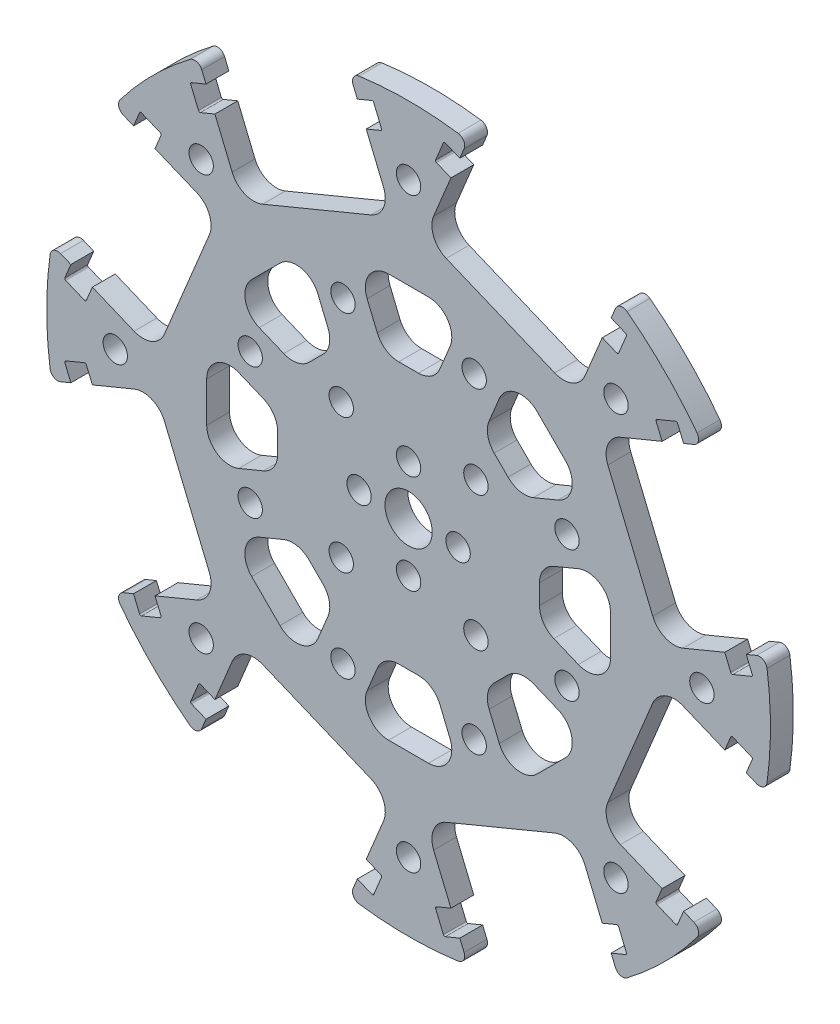
from build123d import *

# Parameters (mm, degrees)
SKETCH_1_R                       = 47.5
EXTRUDE_1_DEPTH                  = 3
CUT_EXTRUDE_1_DEPTH              = 68.242099908
CUT_EXTRUDE_2_DEPTH              = 68.242099908
CUT_EXTRUDE_2_DEPTH_BACK         = 68.242099908
SKETCH_3_R                       = 3.1
SKETCH_3_R_2                     = 1.6
SKETCH_4_R                       = 1.6
CUT_EXTRUDE_3_DEPTH              = 68.242099908
CUT_EXTRUDE_4_DEPTH              = 68.242099908
FILLET_1_R                       = 1
FILLET_2_R                       = 0.2
FILLET_3_R                       = 3.05
FILLET_4_R                       = 3.05
PATTERN_CIRCULAR_1_COUNT         = 8
FILLET_1_OF_PATTERN_CIRCULAR_1_R = 1
FILLET_2_OF_PATTERN_CIRCULAR_1_R = 0.2
FILLET_3_OF_PATTERN_CIRCULAR_1_R = 3.05
FILLET_4_OF_PATTERN_CIRCULAR_1_R = 3.05


with BuildPart() as part:
    # ｽｹｯﾁ1 → ﾎﾞｽ - 押し出し1 (new body)
    with BuildSketch(Plane.XY):
        Circle(SKETCH_1_R)
    extrude(amount=EXTRUDE_1_DEPTH)

    # ｽｹｯﾁ2 → ｶｯﾄ - 押し出し1 (cut, through all)
    with BuildSketch(Plane.XY.offset(3)):
        Polygon((6.724591419, 44.32570355), (10.159175225, 52.617522355), (30.022585174, 44.389828559), (26.588001368, 36.098009755), (28.666730316, 35.236972032), (27.499545848, 32.419139458), (25.420816899, 33.28017718), (21.986233094, 24.988358376), (2.122823145, 33.216052172), (5.55740695, 41.507870976), (3.478678002, 42.368908699), (4.645862471, 45.186741273), align=None)
    cut_extrude_1 = extrude(amount=-CUT_EXTRUDE_1_DEPTH, mode=Mode.SUBTRACT)

    # ｽｹｯﾁ3 → ｶｯﾄ - 押し出し2 (cut, two sides: drawn at the far end of the back side and taken through both)
    with BuildSketch(Plane.XY.offset(3).offset(-CUT_EXTRUDE_2_DEPTH_BACK)):
        Circle(SKETCH_3_R)
        with Locations((0, 6.5)):
            Circle(SKETCH_3_R_2)
        with Locations((6.5, 0)):
            Circle(SKETCH_3_R_2)
        with Locations((0, -6.5)):
            Circle(SKETCH_3_R_2)
        with Locations((-6.5, 0)):
            Circle(SKETCH_3_R_2)
        with Locations((8.838834765, 8.838834765)):
            Circle(SKETCH_3_R_2)
        with Locations((8.838834765, -8.838834765)):
            Circle(SKETCH_3_R_2)
        with Locations((-8.838834765, -8.838834765)):
            Circle(SKETCH_3_R_2)
        with Locations((-8.838834765, 8.838834765)):
            Circle(SKETCH_3_R_2)
    extrude(amount=CUT_EXTRUDE_2_DEPTH + CUT_EXTRUDE_2_DEPTH_BACK, mode=Mode.SUBTRACT)

    # ｽｹｯﾁ4 → ｶｯﾄ - 押し出し3 (cut, through all)
    with BuildSketch(Plane.XY.offset(3)):
        with Locations((27.223611076, 27.223611076)):
            Circle(SKETCH_4_R)
        with Locations((8.610377228, 20.787289482)):
            Circle(SKETCH_4_R)
    cut_extrude_3 = extrude(amount=-CUT_EXTRUDE_3_DEPTH, mode=Mode.SUBTRACT)

    # ｽｹｯﾁ5 → ｶｯﾄ - 押し出し4 (cut, symmetric)
    with BuildSketch(Plane.XY.offset(3)):
        Polygon((3.328075632, 17.180626082), (7.188286702, 26.5), (-7.188286702, 26.5), (-3.328075632, 17.180626082), align=None)
    cut_extrude_4 = extrude(amount=CUT_EXTRUDE_4_DEPTH, both=True, mode=Mode.SUBTRACT)

    # ﾌｨﾚｯﾄ1
    fillet_1_edges = [part.edges().sort_by_distance(p)[0] for p in [
        (27.637535262, 38.631808716, 1.5),
        (7.774125313, 46.859502511, 1.5),
    ]]
    fillet(fillet_1_edges, radius=FILLET_1_R)

    # ﾌｨﾚｯﾄ2
    fillet_2_edges = [part.edges().sort_by_distance(p)[0] for p in [
        (28.666730316, 35.236972032, 1.5),
        (27.499545848, 32.419139458, 1.5),
        (4.645862471, 45.186741273, 1.5),
        (3.478678002, 42.368908699, 1.5),
    ]]
    fillet(fillet_2_edges, radius=FILLET_2_R)

    # ﾌｨﾚｯﾄ3
    fillet_3_edges = [part.edges().sort_by_distance(p)[0] for p in [
        (21.986233094, 24.988358376, 1.5),
        (2.122823145, 33.216052172, 1.5),
    ]]
    fillet(fillet_3_edges, radius=FILLET_3_R)

    # ﾌｨﾚｯﾄ4
    fillet_4_edges = [part.edges().sort_by_distance(p)[0] for p in [
        (7.188286702, 26.5, 1.5),
        (-7.188286702, 26.5, 1.5),
        (3.328075632, 17.180626082, 1.5),
        (-3.328075632, 17.180626082, 1.5),
    ]]
    fillet(fillet_4_edges, radius=FILLET_4_R)

    # 円形ﾊﾟﾀｰﾝ1: ｶｯﾄ - 押し出し1, ｶｯﾄ - 押し出し3, ｶｯﾄ - 押し出し4 ×8 about axis
    pattern_circular_1_axis = Axis((0, 0, 0), (0, 0, 1))
    add([cut_extrude_1.rotate(pattern_circular_1_axis, i * 360 / PATTERN_CIRCULAR_1_COUNT) for i in range(1, PATTERN_CIRCULAR_1_COUNT)], mode=Mode.SUBTRACT)
    add([cut_extrude_3.rotate(pattern_circular_1_axis, i * 360 / PATTERN_CIRCULAR_1_COUNT) for i in range(1, PATTERN_CIRCULAR_1_COUNT)], mode=Mode.SUBTRACT)
    add([cut_extrude_4.rotate(pattern_circular_1_axis, i * 360 / PATTERN_CIRCULAR_1_COUNT) for i in range(1, PATTERN_CIRCULAR_1_COUNT)], mode=Mode.SUBTRACT)

    # ﾌｨﾚｯﾄ1 of 円形ﾊﾟﾀｰﾝ1
    fillet_1_of_pattern_circular_1_edges = [part.edges().sort_by_distance(p)[0] for p in [
        (-7.774125313, 46.859502511, 1.5),
        (-27.637535262, 38.631808716, 1.5),
        (-38.631808716, 27.637535262, 1.5),
        (-46.859502511, 7.774125313, 1.5),
        (-46.859502511, -7.774125313, 1.5),
        (-38.631808716, -27.637535262, 1.5),
        (-27.637535262, -38.631808716, 1.5),
        (-7.774125313, -46.859502511, 1.5),
        (7.774125313, -46.859502511, 1.5),
        (27.637535262, -38.631808716, 1.5),
        (38.631808716, -27.637535262, 1.5),
        (46.859502511, -7.774125313, 1.5),
        (46.859502511, 7.774125313, 1.5),
        (38.631808716, 27.637535262, 1.5),
    ]]
    fillet(fillet_1_of_pattern_circular_1_edges, radius=FILLET_1_OF_PATTERN_CIRCULAR_1_R)

    # ﾌｨﾚｯﾄ2 of 円形ﾊﾟﾀｰﾝ1
    fillet_2_of_pattern_circular_1_edges = [part.edges().sort_by_distance(p)[0] for p in [
        (-4.645862471, 45.186741273, 1.5),
        (-3.478678002, 42.368908699, 1.5),
        (-28.666730316, 35.236972032, 1.5),
        (-27.499545848, 32.419139458, 1.5),
        (-35.236972032, 28.666730316, 1.5),
        (-32.419139458, 27.499545848, 1.5),
        (-45.186741273, 4.645862471, 1.5),
        (-42.368908699, 3.478678002, 1.5),
        (-45.186741273, -4.645862471, 1.5),
        (-42.368908699, -3.478678002, 1.5),
        (-35.236972032, -28.666730316, 1.5),
        (-32.419139458, -27.499545848, 1.5),
        (-28.666730316, -35.236972032, 1.5),
        (-27.499545848, -32.419139458, 1.5),
        (-4.645862471, -45.186741273, 1.5),
        (-3.478678002, -42.368908699, 1.5),
        (4.645862471, -45.186741273, 1.5),
        (3.478678002, -42.368908699, 1.5),
        (28.666730316, -35.236972032, 1.5),
        (27.499545848, -32.419139458, 1.5),
        (35.236972032, -28.666730316, 1.5),
        (32.419139458, -27.499545848, 1.5),
        (45.186741273, -4.645862471, 1.5),
        (42.368908699, -3.478678002, 1.5),
        (45.186741273, 4.645862471, 1.5),
        (42.368908699, 3.478678002, 1.5),
        (35.236972032, 28.666730316, 1.5),
        (32.419139458, 27.499545848, 1.5),
    ]]
    fillet(fillet_2_of_pattern_circular_1_edges, radius=FILLET_2_OF_PATTERN_CIRCULAR_1_R)

    # ﾌｨﾚｯﾄ3 of 円形ﾊﾟﾀｰﾝ1
    fillet_3_of_pattern_circular_1_edges = [part.edges().sort_by_distance(p)[0] for p in [
        (-2.122823145, 33.216052172, 1.5),
        (-21.986233094, 24.988358376, 1.5),
        (-24.988358376, 21.986233094, 1.5),
        (-33.216052172, 2.122823145, 1.5),
        (-33.216052172, -2.122823145, 1.5),
        (-24.988358376, -21.986233094, 1.5),
        (-21.986233094, -24.988358376, 1.5),
        (-2.122823145, -33.216052172, 1.5),
        (2.122823145, -33.216052172, 1.5),
        (21.986233094, -24.988358376, 1.5),
        (24.988358376, -21.986233094, 1.5),
        (33.216052172, -2.122823145, 1.5),
        (33.216052172, 2.122823145, 1.5),
        (24.988358376, 21.986233094, 1.5),
    ]]
    fillet(fillet_3_of_pattern_circular_1_edges, radius=FILLET_3_OF_PATTERN_CIRCULAR_1_R)

    # ﾌｨﾚｯﾄ4 of 円形ﾊﾟﾀｰﾝ1
    fillet_4_of_pattern_circular_1_edges = [part.edges().sort_by_distance(p)[0] for p in [
        (-13.655443429, 23.821215973, 1.5),
        (-23.821215973, 13.655443429, 1.5),
        (-9.79523236, 14.501842056, 1.5),
        (-14.501842056, 9.79523236, 1.5),
        (-26.5, 7.188286702, 1.5),
        (-26.5, -7.188286702, 1.5),
        (-17.180626082, 3.328075632, 1.5),
        (-17.180626082, -3.328075632, 1.5),
        (-23.821215973, -13.655443429, 1.5),
        (-13.655443429, -23.821215973, 1.5),
        (-14.501842056, -9.79523236, 1.5),
        (-9.79523236, -14.501842056, 1.5),
        (-7.188286702, -26.5, 1.5),
        (7.188286702, -26.5, 1.5),
        (-3.328075632, -17.180626082, 1.5),
        (3.328075632, -17.180626082, 1.5),
        (13.655443429, -23.821215973, 1.5),
        (23.821215973, -13.655443429, 1.5),
        (9.79523236, -14.501842056, 1.5),
        (14.501842056, -9.79523236, 1.5),
        (26.5, -7.188286702, 1.5),
        (26.5, 7.188286702, 1.5),
        (17.180626082, -3.328075632, 1.5),
        (17.180626082, 3.328075632, 1.5),
        (23.821215973, 13.655443429, 1.5),
        (13.655443429, 23.821215973, 1.5),
        (14.501842056, 9.79523236, 1.5),
        (9.79523236, 14.501842056, 1.5),
    ]]
    fillet(fillet_4_of_pattern_circular_1_edges, radius=FILLET_4_OF_PATTERN_CIRCULAR_1_R)


solid = part.part
